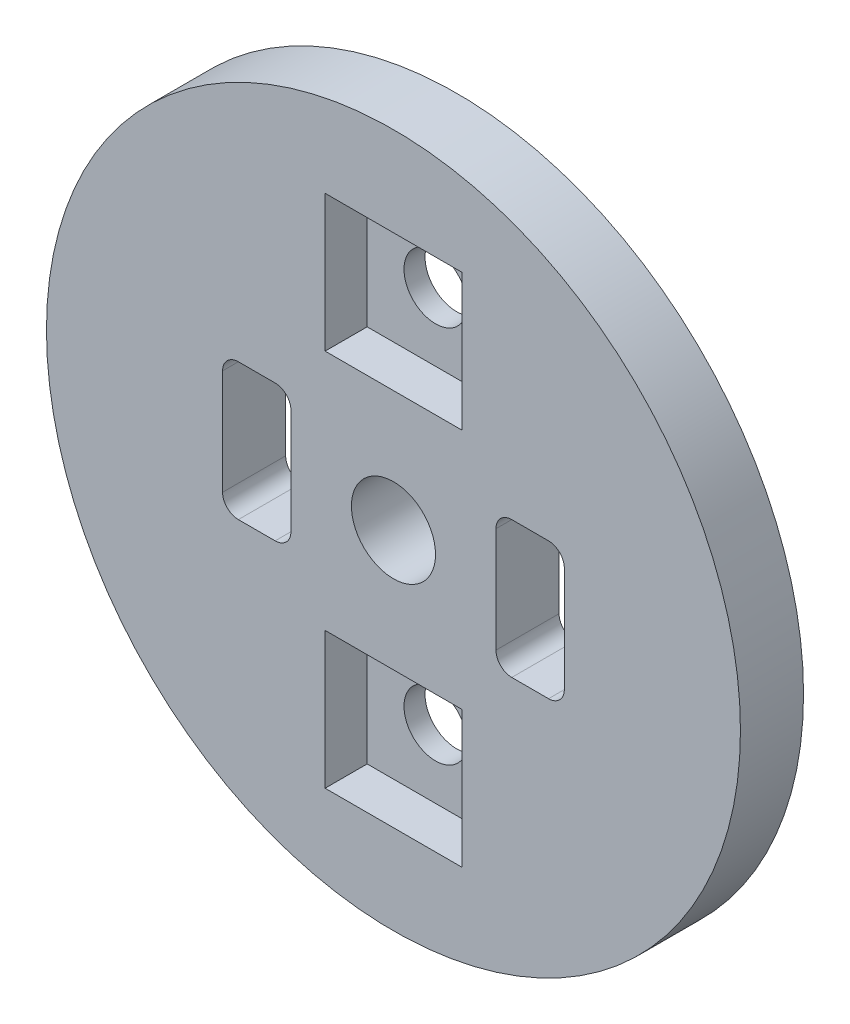
from build123d import *

# Parameters (mm, degrees)
MODEL_R                 = 16.5
MODEL_R_2               = 1.5
MODEL_R_3               = 2
SALIENTE_EXTRUIR1_DEPTH = 3
CROQUIS2_W              = 6.5
CROQUIS2_H              = 6.5
CROQUIS2_W_2            = 6.500000001
CORTAR_EXTRUIR1_DEPTH   = 2


with BuildPart() as part:
    # Model → Saliente-Extruir1 (new body)
    with BuildSketch(Plane.XY):
        with Locations((215.747807914, 241.952019993)):
            Circle(MODEL_R)
        with Locations((215.747807914, 250.952019993)):
            Circle(MODEL_R_2, mode=Mode.SUBTRACT)
        with BuildLine():
            ThreePointArc((207.622807913, 244.452019993), (207.842477828, 244.982350079), (208.372807913, 245.202019993))
            Line((208.372807913, 245.202019993), (210.122807913, 245.202019993))
            ThreePointArc((210.122807913, 245.202019993), (210.653137999, 244.982350079), (210.872807913, 244.452019993))
            Line((210.872807913, 244.452019993), (210.872807913, 239.452019993))
            ThreePointArc((210.872807914, 239.452019993), (210.653137999, 238.921689907), (210.122807913, 238.702019993))
            Line((210.122807913, 238.702019993), (208.372807913, 238.702019993))
            ThreePointArc((208.372807913, 238.702019993), (207.842477828, 238.921689907), (207.622807913, 239.452019993))
            Line((207.622807913, 239.452019993), (207.622807913, 244.452019993))
        make_face(mode=Mode.SUBTRACT)
        with BuildLine():
            Line((221.372807913, 245.202019993), (223.122807913, 245.202019993))
            ThreePointArc((223.122807913, 245.202019993), (223.653137999, 244.982350079), (223.872807913, 244.452019993))
            Line((223.872807913, 244.452019993), (223.872807913, 239.452019993))
            ThreePointArc((223.872807914, 239.452019993), (223.653137999, 238.921689907), (223.122807913, 238.702019993))
            Line((223.122807913, 238.702019993), (221.372807913, 238.702019993))
            ThreePointArc((221.372807913, 238.702019993), (220.842477828, 238.921689907), (220.622807913, 239.452019993))
            Line((220.622807913, 239.452019993), (220.622807913, 244.452019993))
            ThreePointArc((220.622807913, 244.452019993), (220.842477828, 244.982350079), (221.372807913, 245.202019993))
        make_face(mode=Mode.SUBTRACT)
        with Locations((215.747807914, 241.952019993)):
            Circle(MODEL_R_3, mode=Mode.SUBTRACT)
        with Locations((215.747807914, 232.952019993)):
            Circle(MODEL_R_2, mode=Mode.SUBTRACT)
    extrude(amount=SALIENTE_EXTRUIR1_DEPTH)

    # Croquis2 → Cortar-Extruir1 (cut)
    with BuildSketch(Plane.XY.offset(3)):
        with Locations((215.747807914, 250.952019993)):
            Rectangle(CROQUIS2_W, CROQUIS2_H)
        with Locations((215.747807914, 232.952019993)):
            Rectangle(CROQUIS2_W_2, CROQUIS2_H)
    extrude(amount=-CORTAR_EXTRUIR1_DEPTH, mode=Mode.SUBTRACT)


solid = part.part
